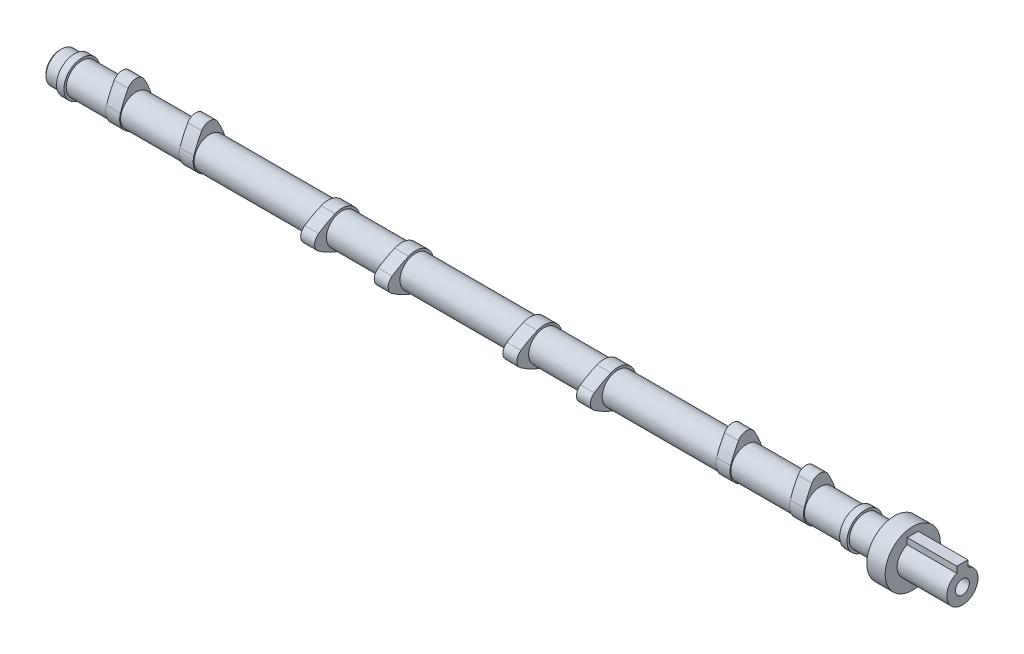
from build123d import *

# Parameters (mm, degrees)
CROQUIS1_W                       = 580
CROQUIS1_H                       = 8.5
CROQUIS4_R                       = 9.75
SALIENTE_EXTRUIR1_DEPTH          = 4
MATRIZL1_COUNT                   = 2
MATRIZL1_PITCH                   = 442
SALIENTE_EXTRUIR3_DEPTH          = 3.8
MATRIZL2_COUNT                   = 2
MATRIZL2_PITCH                   = 40
MATRIZL3_COUNT                   = 2
MATRIZL3_PITCH                   = 332
MATRIZL3_COPY_1_DEPTH            = 3.8
CROQUIS6_R                       = 8.5
SALIENTE_EXTRUIR4_DEPTH          = 3.8
MATRIZL4_COUNT                   = 2
MATRIZL4_PITCH                   = 40
MATRIZL5_COUNT                   = 2
MATRIZL5_PITCH                   = 110
MATRIZL5_COPY_1_SKETCH_R         = 8.5
MATRIZL5_COPY_1_DEPTH            = 3.8
CROQUIS8_R                       = 10
CORTAR_EXTRUIR1_DEPTH            = 36
CROQUIS9_R                       = 9.75
SALIENTE_EXTRUIR5_DEPTH          = 4
CROQUIS10_R                      = 8.5
SALIENTE_EXTRUIR6_DEPTH          = 8
CHAFL_N1_SIZE                    = 1
SALIENTE_EXTRUIR7_DEPTH          = 5
SALIENTE_EXTRUIR7_DEPTH_BACK     = 5
CROQUIS12_R                      = 15
CROQUIS13_W                      = 6
CROQUIS13_H                      = 3.35
SALIENTE_EXTRUIR8_DEPTH          = 40
CORTAR_EXTRUIR2_START            = -81
CROQUIS15_R                      = 35.701734295
CORTAR_EXTRUIR2_DEPTH            = 81
TALADRO_DE_MARGEN_PARA_M71_D     = 7.6
TALADRO_DE_MARGEN_PARA_M71_DEPTH = 30
TALADRO_DE_MARGEN_PARA_M71_TIP   = 2.283270352


with BuildPart() as part:
    # Croquis1 → Revolución1 (revolve)
    with BuildSketch(Plane.XY, mode=Mode.PRIVATE) as revoluci_n1_sk:
        with Locations((290, 4.25)):
            Rectangle(CROQUIS1_W, CROQUIS1_H)
    revolve(revoluci_n1_sk.sketch.rotate(Axis((0, 8.5, 0), (1, 0, 0)), 270), axis=Axis((0, 8.5, 0), (1, 0, 0)))

    # Croquis4 → Saliente-Extruir1 (add)
    with BuildSketch(Plane(origin=(580, 0, 0), x_dir=(0, 0, -1), z_dir=(1, 0, 0))):
        with Locations((0, 8.5)):
            Circle(CROQUIS4_R)
    saliente_extruir1 = extrude(amount=-SALIENTE_EXTRUIR1_DEPTH)

    # MatrizL1: Saliente-Extruir1 ×2
    with Locations(*[(-i * MATRIZL1_PITCH, 0, 0) for i in range(1, MATRIZL1_COUNT)]):
        add(saliente_extruir1)

    # Croquis5 → Saliente-Extruir3 (add, symmetric)
    with BuildSketch(Plane(origin=(162.25, 0, 0), x_dir=(0, 0, -1), z_dir=(1, 0, 0))):
        with BuildLine():
            ThreePointArc((-8.57686354, 11.227161863), (0, -0.5), (8.57686354, 11.227161863))
            ThreePointArc((8.57686354, 11.227161863), (6.71423124, 16.165722115), (4.341375372, 20.880415264))
            ThreePointArc((4.341375372, 20.880415264), (0, 23.4), (-4.341375372, 20.880415264))
            ThreePointArc((-4.341375372, 20.880415264), (-6.71423124, 16.165722115), (-8.57686354, 11.227161863))
        make_face()
    saliente_extruir3 = extrude(amount=SALIENTE_EXTRUIR3_DEPTH, both=True)

    # MatrizL2: Saliente-Extruir3 ×2
    with Locations(*[(i * MATRIZL2_PITCH, 0, 0) for i in range(1, MATRIZL2_COUNT)]):
        add(saliente_extruir3)

    # MatrizL3: Saliente-Extruir3 ×2
    with Locations(*[(i * MATRIZL3_PITCH, 0, 0) for i in range(1, MATRIZL3_COUNT)]):
        add(saliente_extruir3)

    # MatrizL3 copy 1 sketch → MatrizL3 copy 1 (add, symmetric)
    with BuildSketch(Plane(origin=(534.25, 0, 0), x_dir=(0, 0, -1), z_dir=(1, 0, 0))):
        with BuildLine():
            ThreePointArc((-8.57686354, 11.227161863), (0, -0.5), (8.57686354, 11.227161863))
            ThreePointArc((8.57686354, 11.227161863), (6.71423124, 16.165722115), (4.341375372, 20.880415264))
            ThreePointArc((4.341375372, 20.880415264), (0, 23.4), (-4.341375372, 20.880415264))
            ThreePointArc((-4.341375372, 20.880415264), (-6.71423124, 16.165722115), (-8.57686354, 11.227161863))
        make_face()
    extrude(amount=MATRIZL3_COPY_1_DEPTH, both=True)

    # Croquis6 → Saliente-Extruir4 (add, symmetric)
    with BuildSketch(Plane(origin=(272.25, 0, 0), x_dir=(0, 0, -1), z_dir=(1, 0, 0))):
        with BuildLine():
            ThreePointArc((-12.722376543, 12.627249768), (-14.9, 8.5), (-12.722376543, 4.372750232))
            ThreePointArc((-12.722376543, 4.372750232), (-8.363270987, 1.70804262), (-3.754994824, -0.497917196))
            ThreePointArc((-3.754994824, -0.497917196), (9.75, 8.5), (-3.754994824, 17.497917196))
            ThreePointArc((-3.754994824, 17.497917196), (-8.363270987, 15.29195738), (-12.722376543, 12.627249768))
        make_face()
        with Locations(Location((0, 8.5, 0), (0, 0, 180))):
            Circle(CROQUIS6_R, mode=Mode.SUBTRACT)
    saliente_extruir4 = extrude(amount=SALIENTE_EXTRUIR4_DEPTH, both=True)

    # MatrizL4: Saliente-Extruir4 ×2
    with Locations(*[(i * MATRIZL4_PITCH, 0, 0) for i in range(1, MATRIZL4_COUNT)]):
        add(saliente_extruir4)

    # MatrizL5: Saliente-Extruir4 ×2
    with Locations(*[(i * MATRIZL5_PITCH, 0, 0) for i in range(1, MATRIZL5_COUNT)]):
        add(saliente_extruir4)

    # MatrizL5 copy 1 sketch → MatrizL5 copy 1 (add, symmetric)
    with BuildSketch(Plane(origin=(422.25, 0, 0), x_dir=(0, 0, -1), z_dir=(1, 0, 0))):
        with BuildLine():
            ThreePointArc((-12.722376543, 12.627249768), (-14.9, 8.5), (-12.722376543, 4.372750232))
            ThreePointArc((-12.722376543, 4.372750232), (-8.363270987, 1.70804262), (-3.754994824, -0.497917196))
            ThreePointArc((-3.754994824, -0.497917196), (9.75, 8.5), (-3.754994824, 17.497917196))
            ThreePointArc((-3.754994824, 17.497917196), (-8.363270987, 15.29195738), (-12.722376543, 12.627249768))
        make_face()
        with Locations(Location((0, 8.5, 0), (0, 0, 180))):
            Circle(MATRIZL5_COPY_1_SKETCH_R, mode=Mode.SUBTRACT)
    extrude(amount=MATRIZL5_COPY_1_DEPTH, both=True)

    # Croquis8 → Cortar-Extruir1 (cut)
    with BuildSketch(Plane(origin=(564, 0, 0), x_dir=(0, 0, -1), z_dir=(1, 0, 0))):
        with Locations((0, 8.5)):
            Circle(CROQUIS8_R)
    extrude(amount=CORTAR_EXTRUIR1_DEPTH, mode=Mode.SUBTRACT)

    # Croquis9 → Saliente-Extruir5 (add)
    with BuildSketch(Plane(origin=(564, 0, 0), x_dir=(0, 0, -1), z_dir=(1, 0, 0))):
        with Locations((0, 8.5)):
            Circle(CROQUIS9_R)
    extrude(amount=-SALIENTE_EXTRUIR5_DEPTH)


with BuildPart() as body_2:
    # Simetría1: mirrored copy
    add(part.part.mirror(Plane.ZY))

    # Croquis10 → Saliente-Extruir6 (add)
    with BuildSketch(Plane.ZY.offset(564)):
        with Locations((0, 8.5)):
            Circle(CROQUIS10_R)
    extrude(amount=SALIENTE_EXTRUIR6_DEPTH)

    # Chaflán1
    chafl_n1_edges = [body_2.edges().sort_by_distance(p)[0] for p in [
        (-572, 8.5, -8.5),
    ]]
    chamfer(chafl_n1_edges, length=CHAFL_N1_SIZE)

    # Croquis12 → Saliente-Extruir7 (add, two sides: drawn at the far end of the back side and taken through both)
    with BuildSketch(Plane(origin=(-113, 0, 0), x_dir=(0, 0, -1), z_dir=(1, 0, 0)).offset(-SALIENTE_EXTRUIR7_DEPTH_BACK)):
        with Locations((0, 8.5)):
            Circle(CROQUIS12_R)
    extrude(amount=SALIENTE_EXTRUIR7_DEPTH + SALIENTE_EXTRUIR7_DEPTH_BACK)

    # Croquis13 → Saliente-Extruir8 (add)
    with BuildSketch(Plane(origin=(-108, 0, 0), x_dir=(0, 0, -1), z_dir=(1, 0, 0))):
        with Locations((0, 18.12798686)):
            Rectangle(CROQUIS13_W, CROQUIS13_H)
    extrude(amount=SALIENTE_EXTRUIR8_DEPTH)

    # Croquis15 → Cortar-Extruir2 (cut)
    with BuildSketch(Plane(origin=(0, 0, 0), x_dir=(0, 0, -1), z_dir=(1, 0, 0)).offset(CORTAR_EXTRUIR2_START)):
        with Locations((0, 8.5)):
            Circle(CROQUIS15_R)
    extrude(amount=CORTAR_EXTRUIR2_DEPTH, mode=Mode.SUBTRACT)

    # Taladro de margen para M71
    with Locations(Plane(origin=(-81, 8.5, 0), x_dir=(0, 0, 1), z_dir=(1, 0, 0))):
        with Locations((0, 0)):
            Hole(TALADRO_DE_MARGEN_PARA_M71_D / 2, depth=TALADRO_DE_MARGEN_PARA_M71_DEPTH)
            with Locations((0, 0, -(TALADRO_DE_MARGEN_PARA_M71_DEPTH + TALADRO_DE_MARGEN_PARA_M71_TIP / 2))):  # 118° drill point
                Cone(0, TALADRO_DE_MARGEN_PARA_M71_D / 2, TALADRO_DE_MARGEN_PARA_M71_TIP, mode=Mode.SUBTRACT)


solid = body_2.part
